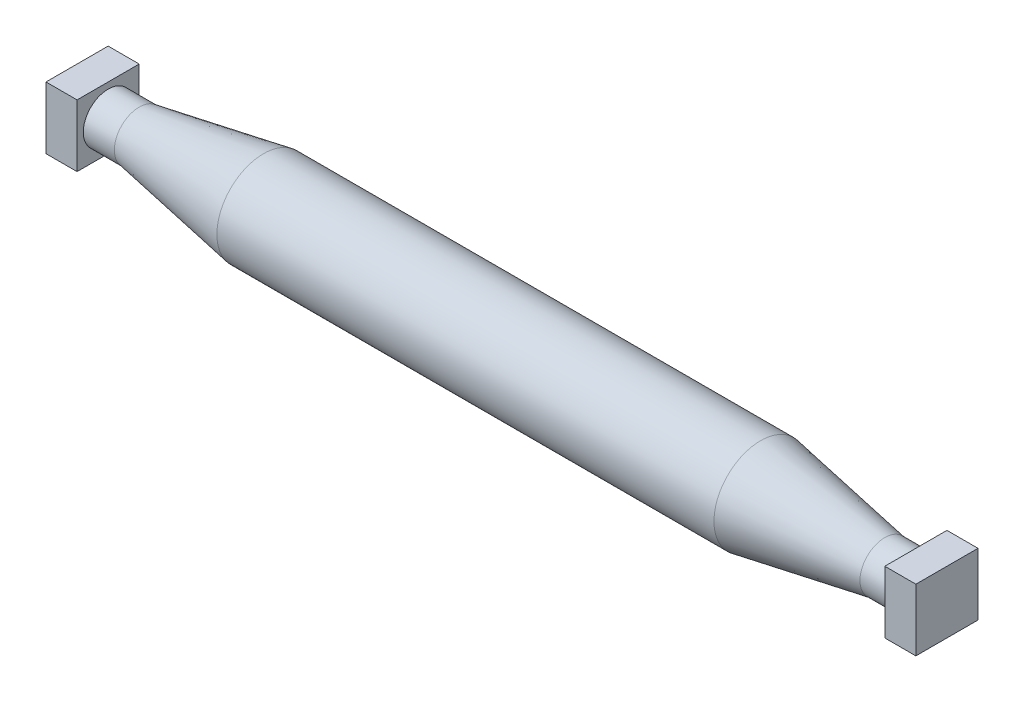
from build123d import *

# Parameters (mm, degrees)
SKETCH1_W           = 12.7
SKETCH1_H           = 10.16
SKETCH3_W           = 25.4
SKETCH3_H           = 25.4
BOSS_EXTRUDE2_DEPTH = 12.7


with BuildPart() as part:
    # Sketch1 → Revolve3 (revolve)
    with BuildSketch(Plane.XY, mode=Mode.PRIVATE) as revolve3_sk:
        Polygon((101.6, 19.05), (0, 19.05), (0, 0), (152.4, 0), (152.4, 10.16), align=None)
        with Locations((158.75, 5.08)):
            Rectangle(SKETCH1_W, SKETCH1_H)
    revolve(revolve3_sk.sketch.rotate(Axis((0, 0, 0), (1, 0, 0)), 180), axis=Axis((0, 0, 0), (1, 0, 0)))

    # Sketch3 → Boss-Extrude2 (add)
    with BuildSketch(Plane(origin=(165.1, 0, 0), x_dir=(0, 0, -1), z_dir=(1, 0, 0))):
        Rectangle(SKETCH3_W, SKETCH3_H)
    extrude(amount=BOSS_EXTRUDE2_DEPTH)

    # Mirror1: part across plane


with BuildPart() as part_1:
    add(part.part)
    add(part.part.mirror(Plane(origin=(0, 0, 0), x_dir=(0, 0, 1), z_dir=(1, 0, 0))))


solid = part_1.part
